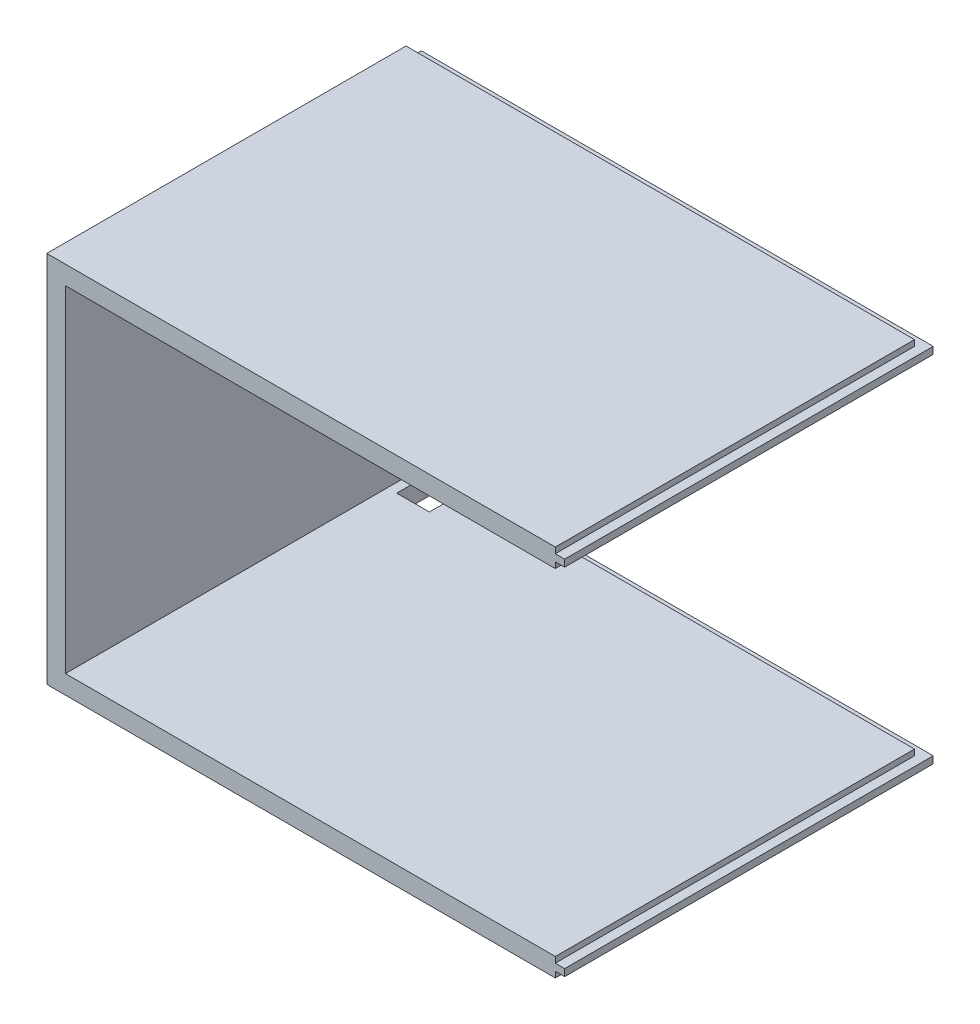
from build123d import *

# Parameters (mm, degrees)
Y_KSEKLIK_EKSTR_ZYON2_DEPTH = 77
IZIM3_W                     = 2
IZIM3_H                     = 1.25
KES_EKSTR_ZYON1_DEPTH       = 77
IZIM6_W                     = 1.5
IZIM6_H                     = 74.5
Y_KSEKLIK_EKSTR_ZYON3_DEPTH = 2
IZIM7_W                     = 7
IZIM7_H                     = 10
KES_EKSTR_ZYON2_DEPTH       = 10


with BuildPart() as part:
    # Çizim2 → Yükseklik-Ekstrüzyon2 (new body)
    with BuildSketch(Plane.XY):
        Polygon((55.5, 40), (-55.5, 40), (-55.5, -40), (55.5, -40), (55.5, -36), (-51.5, -36), (-51.5, 36), (55.5, 36), align=None)
    extrude(amount=-Y_KSEKLIK_EKSTR_ZYON2_DEPTH)

    # Çizim3 → Kes-Ekstrüzyon1 (cut)
    with BuildSketch(Plane(origin=(0, 0, -77), x_dir=(-1, 0, 0), z_dir=(0, 0, -1))):
        with Locations((-54.5, -36.625)):
            Rectangle(IZIM3_W, IZIM3_H)
        with Locations((-54.5, -39.375)):
            Rectangle(IZIM3_W, IZIM3_H)
        with Locations((-54.5, 39.375)):
            Rectangle(IZIM3_W, IZIM3_H)
        with Locations((-54.5, 36.625)):
            Rectangle(IZIM3_W, IZIM3_H)
    extrude(amount=-KES_EKSTR_ZYON1_DEPTH, mode=Mode.SUBTRACT)

    # Çizim6 → Yükseklik-Ekstrüzyon3 (add)
    with BuildSketch(Plane(origin=(0, 0, -77), x_dir=(-1, 0, 0), z_dir=(0, 0, -1))):
        Polygon((-53.5, 38.75), (-55.5, 38.75), (-55.5, 37.25), (-53.5, 37.25), (52.75, 37.25), (54.25, 37.25), (54.25, 38.75), align=None)
        with Locations((53.5, 0)):
            Rectangle(IZIM6_W, IZIM6_H)
        Polygon((54.25, -38.75), (54.25, -37.25), (52.75, -37.25), (-53.5, -37.25), (-55.5, -37.25), (-55.5, -38.75), (-53.5, -38.75), align=None)
    extrude(amount=Y_KSEKLIK_EKSTR_ZYON3_DEPTH)

    # Çizim7 → Kes-Ekstrüzyon2 (cut)
    with BuildSketch(Plane.XZ.offset(40)):
        with Locations((-46, -74)):
            Rectangle(IZIM7_W, IZIM7_H)
    extrude(amount=-KES_EKSTR_ZYON2_DEPTH, mode=Mode.SUBTRACT)


solid = part.part
